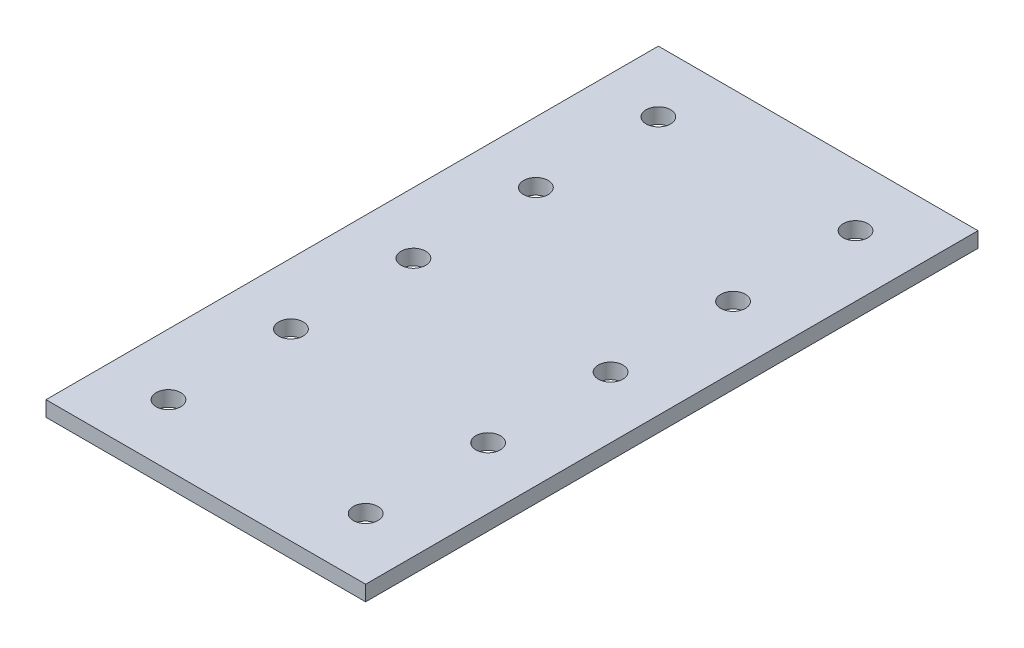
from build123d import *

# Parameters (mm, degrees)
SKETCH1_W            = 66.294
SKETCH1_H            = 127
BOSS_EXTRUDE1_DEPTH  = 3.175
SKETCH2_R            = 2.5527
CUT_EXTRUDE1_DEPTH   = 3.175
LPATTERN1_COUNT      = 2
LPATTERN1_PITCH      = 40.894
LPATTERN1_COUNT_DIR2 = 5
LPATTERN1_PITCH_DIR2 = 25.4


with BuildPart() as part:
    # Sketch1 → Boss-Extrude1 (new body)
    with BuildSketch(Plane(origin=(0, 0, 0), x_dir=(1, 0, 0), z_dir=(0, 1, 0))):
        Rectangle(SKETCH1_W, SKETCH1_H)
    extrude(amount=BOSS_EXTRUDE1_DEPTH)

    # Sketch2 → Cut-Extrude1 (cut)
    with BuildSketch(Plane(origin=(0, 3.175, 0), x_dir=(1, 0, 0), z_dir=(0, 1, 0))):
        with Locations(Location((-20.447, -50.8, 0), (0, 0, 270))):
            Circle(SKETCH2_R)
    cut_extrude1 = extrude(amount=-CUT_EXTRUDE1_DEPTH, mode=Mode.SUBTRACT)

    # LPattern1: Cut-Extrude1 2 × 5
    with Locations(*[(i * LPATTERN1_PITCH, 0, -j * LPATTERN1_PITCH_DIR2) for i in range(LPATTERN1_COUNT) for j in range(LPATTERN1_COUNT_DIR2) if (i, j) != (0, 0)]):
        add(cut_extrude1, mode=Mode.SUBTRACT)


solid = part.part
